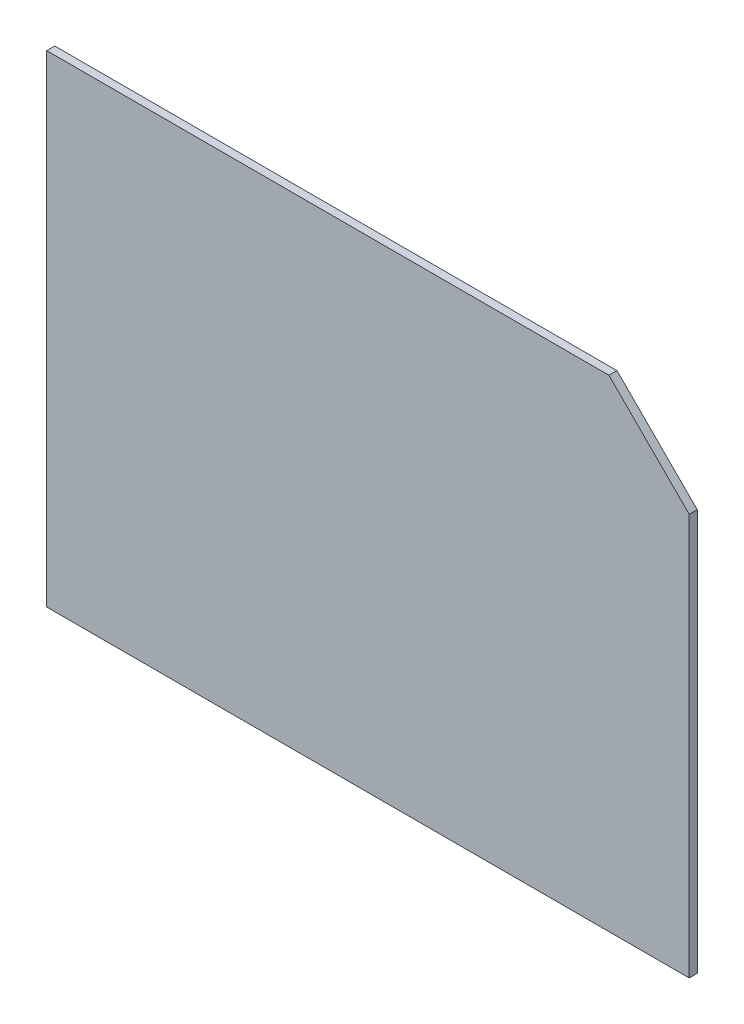
from build123d import *

# Parameters (mm, degrees)
SKETCH2_W           = 2000
SKETCH2_H           = 1500
BOSS_EXTRUDE1_DEPTH = 25
CUT_EXTRUDE1_DEPTH  = 932


with BuildPart() as part:
    # Sketch2 → Boss-Extrude1 (new body)
    with BuildSketch(Plane.XY):
        Rectangle(SKETCH2_W, SKETCH2_H)
    extrude(amount=-BOSS_EXTRUDE1_DEPTH)

    # Sketch3 → Cut-Extrude1 (cut)
    with BuildSketch(Plane.XY):
        Polygon((1000, 500), (1000, 750), (750, 750), align=None)
    extrude(amount=-CUT_EXTRUDE1_DEPTH, mode=Mode.SUBTRACT)


solid = part.part
